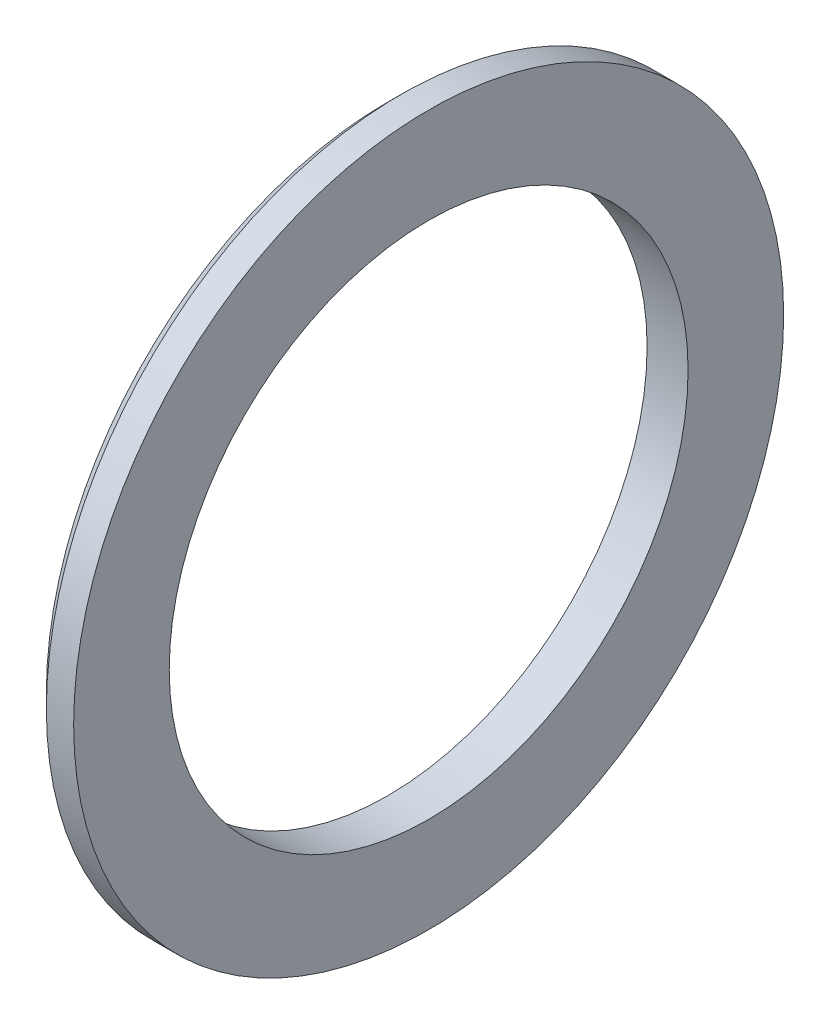
from build123d import *


with BuildPart() as part:
    # Эскиз1 → Повернуть1 (revolve)
    with BuildSketch(Plane.XY, mode=Mode.PRIVATE) as revolve_1_sk:
        Polygon((0, 19), (0, 25), (1, 26), (3, 26), (3, 19), align=None)
    revolve(revolve_1_sk.sketch.rotate(Axis((0, 0, 0), (1, 0, 0)), 90), axis=Axis((0, 0, 0), (1, 0, 0)))


solid = part.part
